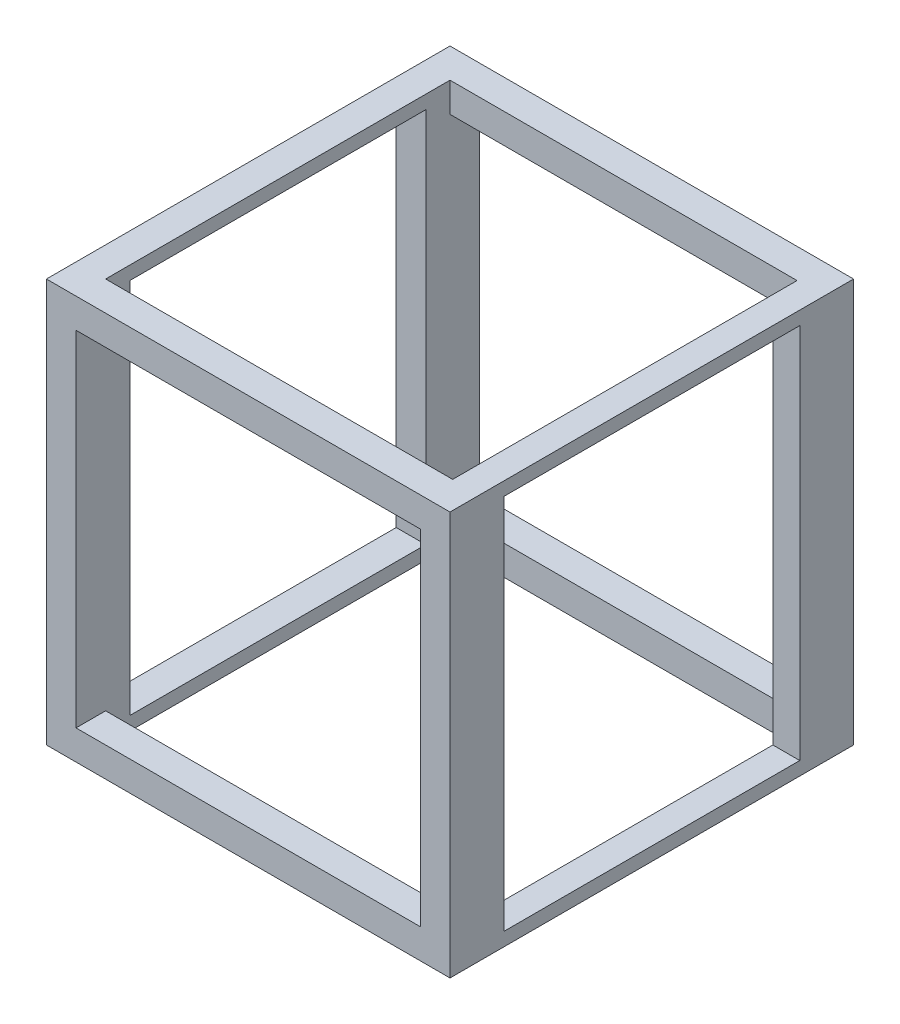
from build123d import *

# Parameters (mm, degrees)
SKETCH_3_W               = 1500
SKETCH_3_H               = 1500
EXTRUDE_1_DEPTH          = 1500
CUT_EXTRUDE_1_DEPTH      = 2346.207879912
CUT_EXTRUDE_1_DEPTH_BACK = 2346.207879912
SKETCH_4_W               = 1100
SKETCH_4_H               = 1400
CUT_EXTRUDE_2_DEPTH      = 2346.207879912
CUT_EXTRUDE_2_DEPTH_BACK = 2346.207879912
SKETCH_5_W               = 1280
SKETCH_5_H               = 1280
CUT_EXTRUDE_3_DEPTH      = 2346.207879912
CUT_EXTRUDE_3_DEPTH_BACK = 2346.207879912
SKETCH_6_W               = 1290
SKETCH_6_H               = 1280


with BuildPart() as part:
    # 草图3 → 凸台-拉伸1 (new body)
    with BuildSketch(Plane(origin=(0, 0, 0), x_dir=(1, 0, 0), z_dir=(0, 1, 0))):
        with Locations((750, 750)):
            Rectangle(SKETCH_3_W, SKETCH_3_H)
    extrude(amount=EXTRUDE_1_DEPTH)

    # 草图4 → 切除-拉伸1 (cut, two sides: drawn at the far end of the back side and taken through both)
    with BuildSketch(Plane(origin=(1000, 0, 0), x_dir=(0, 0, -1), z_dir=(1, 0, 0)).offset(-CUT_EXTRUDE_1_DEPTH_BACK)):
        with Locations((750, 750)):
            Rectangle(SKETCH_4_W, SKETCH_4_H)
    extrude(amount=CUT_EXTRUDE_1_DEPTH + CUT_EXTRUDE_1_DEPTH_BACK, mode=Mode.SUBTRACT)

    # 草图5 → 切除-拉伸2 (cut, two sides: drawn at the far end of the back side and taken through both)
    with BuildSketch(Plane(origin=(0, 0, -1000), x_dir=(-1, 0, 0), z_dir=(0, 0, -1)).offset(-CUT_EXTRUDE_2_DEPTH_BACK)):
        with Locations((-750, 750)):
            Rectangle(SKETCH_5_W, SKETCH_5_H)
    extrude(amount=CUT_EXTRUDE_2_DEPTH + CUT_EXTRUDE_2_DEPTH_BACK, mode=Mode.SUBTRACT)

    # 草图6 → 切除-拉伸3 (cut, two sides: drawn at the far end of the back side and taken through both)
    with BuildSketch(Plane(origin=(0, 500, 0), x_dir=(-1, 0, 0), z_dir=(0, -1, 0)).offset(-CUT_EXTRUDE_3_DEPTH_BACK)):
        with Locations((-755, 750)):
            Rectangle(SKETCH_6_W, SKETCH_6_H)
    extrude(amount=CUT_EXTRUDE_3_DEPTH + CUT_EXTRUDE_3_DEPTH_BACK, mode=Mode.SUBTRACT)


solid = part.part
